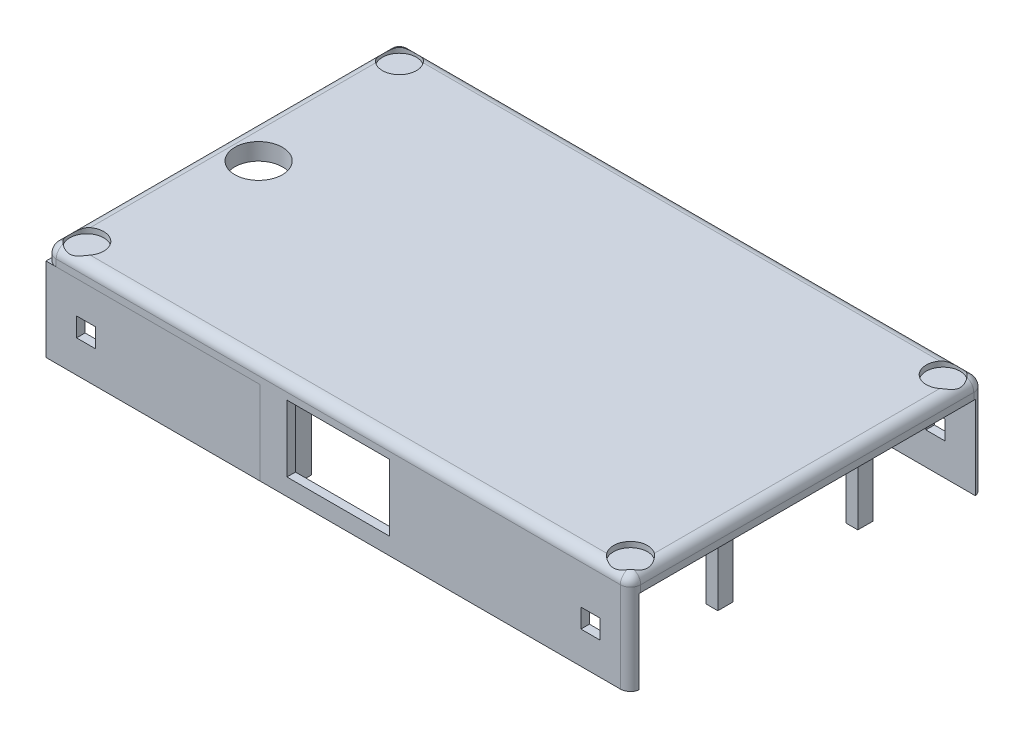
from build123d import *

# Parameters (mm, degrees)
ESBO_O1_W                 = 172
ESBO_O1_H                 = 104
RESSALTO_EXTRUS_O1_DEPTH  = 5
ESBO_O6_W                 = 63.01
ESBO_O6_H                 = 24.6
RESSALTO_EXTRUS_O3_DEPTH  = 2.5
ESBO_O9_W                 = 5.6
ESBO_O9_H                 = 5.6
CORTE_EXTRUS_O1_DEPTH     = 5
ESBO_O10_W                = 63
ESBO_O10_H                = 24.6
RESSALTO_EXTRUS_O4_DEPTH  = 2.5
ESBO_O11_W                = 5.6
ESBO_O11_H                = 5.6
CORTE_EXTRUS_O2_DEPTH     = 5
ESBO_O12_W                = 63
ESBO_O12_H                = 24.6
RESSALTO_EXTRUS_O5_DEPTH  = 2.5
ESBO_O15_W                = 63
ESBO_O15_H                = 24.6
RESSALTO_EXTRUS_O6_DEPTH  = 2.5
ESBO_O18_W                = 5.6
ESBO_O18_H                = 5.6
CORTE_EXTRUS_O5_DEPTH     = 10
ESBO_O19_W                = 5.6
ESBO_O19_H                = 5.6
CORTE_EXTRUS_O6_DEPTH     = 10
ESBO_O20_W                = 7.9
ESBO_O20_H                = 24.6
RESSALTO_EXTRUS_O7_DEPTH  = 2.5
ESBO_O21_W                = 7.89
ESBO_O21_H                = 24.6
RESSALTO_EXTRUS_O8_DEPTH  = 2.5
ESBO_O25_W                = 3.92
ESBO_O25_H                = 6.6
RESSALTO_EXTRUS_O9_DEPTH  = 24.6
ESBO_O27_W                = 3.92
ESBO_O27_H                = 6.6
RESSALTO_EXTRUS_O10_DEPTH = 24.6
ESBO_O28_W                = 2.5
ESBO_O28_H                = 5
RESSALTO_EXTRUS_O11_DEPTH = 30.6
ESBO_O29_W                = 7.9
ESBO_O29_H                = 24.6
RESSALTO_EXTRUS_O12_DEPTH = 2.5
ESBO_O30_W                = 7.9
ESBO_O30_H                = 24.6
RESSALTO_EXTRUS_O13_DEPTH = 2.5
ESBO_O31_W                = 3.92
ESBO_O31_H                = 6.6
RESSALTO_EXTRUS_O14_DEPTH = 24.6
ESBO_O32_W                = 3.92
ESBO_O32_H                = 4.1
RESSALTO_EXTRUS_O15_DEPTH = 24.6
ESBO_O34_W                = 30.2
ESBO_O34_H                = 5
RESSALTO_EXTRUS_O16_DEPTH = 2.5
FILETE3_R                 = 3
FILETE4_R                 = 3
FILETE5_R                 = 3
FILETE6_R                 = 3
ESBO_O53_R                = 7
CORTE_EXTRUS_O12_DEPTH    = 134
ESBO_O55_W                = 3.5
ESBO_O55_H                = 4.5
RESSALTO_EXTRUS_O29_DEPTH = 20.1
ESBO_O57_W                = 3.5
ESBO_O57_H                = 4.5
RESSALTO_EXTRUS_O30_DEPTH = 20.1
ESBO_O58_W                = 3.5
ESBO_O58_H                = 36.697857
RESSALTO_EXTRUS_O31_DEPTH = 4
ESBO_O49_R                = 5
CORTE_EXTRUS_O13_DEPTH    = 1.6
ESBO_O47_R                = 5
CORTE_EXTRUS_O14_DEPTH    = 1.6
ESBO_O44_R                = 5
CORTE_EXTRUS_O15_DEPTH    = 1.6
ESBO_O48_R                = 5
CORTE_EXTRUS_O16_DEPTH    = 1.6


with BuildPart() as part:
    # Esboço1 → Ressalto-extrusão1 (new body)
    with BuildSketch(Plane(origin=(0, 0, 0), x_dir=(1, 0, 0), z_dir=(0, 1, 0))):
        with Locations((-16.61286323, 0.238185856)):
            Rectangle(ESBO_O1_W, ESBO_O1_H)
    extrude(amount=RESSALTO_EXTRUS_O1_DEPTH)



with BuildPart() as body_2:
    # Esboço6 → Ressalto-extrusão3 (new body)
    with BuildSketch(Plane.XY.offset(51.761814144)):
        with Locations((-71.10786323, -12.3)):
            Rectangle(ESBO_O6_W, ESBO_O6_H)
    extrude(amount=-RESSALTO_EXTRUS_O3_DEPTH)

    # Esboço9 → Corte-extrusão1 (cut)
    with BuildSketch(Plane(origin=(0, 0, 49.261814144), x_dir=(-1, 0, 0), z_dir=(0, 0, -1))):
        with Locations((90.81286323, -12.3)):
            Rectangle(ESBO_O9_W, ESBO_O9_H)
    extrude(amount=-CORTE_EXTRUS_O1_DEPTH, mode=Mode.SUBTRACT)


with BuildPart() as body_3:
    # Esboço10 → Ressalto-extrusão4 (new body)
    with BuildSketch(Plane(origin=(0, 0, -52.238185856), x_dir=(-1, 0, 0), z_dir=(0, 0, -1))):
        with Locations((71.11286323, -12.3)):
            Rectangle(ESBO_O10_W, ESBO_O10_H)
    extrude(amount=-RESSALTO_EXTRUS_O4_DEPTH)

    # Esboço11 → Corte-extrusão2 (cut)
    with BuildSketch(Plane.XY.offset(-49.738185856)):
        with Locations((-90.81286323, -12.3)):
            Rectangle(ESBO_O11_W, ESBO_O11_H)
    extrude(amount=-CORTE_EXTRUS_O2_DEPTH, mode=Mode.SUBTRACT)


with BuildPart() as body_4:
    # Esboço12 → Ressalto-extrusão5 (new body)
    with BuildSketch(Plane(origin=(0, 0, -52.238185856), x_dir=(-1, 0, 0), z_dir=(0, 0, -1))):
        with Locations((-37.88713677, -12.3)):
            Rectangle(ESBO_O12_W, ESBO_O12_H)
    extrude(amount=-RESSALTO_EXTRUS_O5_DEPTH)

    # Esboço18 → Corte-extrusão5 (cut)
    with BuildSketch(Plane(origin=(0, 0, -52.238185856), x_dir=(-1, 0, 0), z_dir=(0, 0, -1))):
        with Locations((-57.58713677, -12.3)):
            Rectangle(ESBO_O18_W, ESBO_O18_H)
    extrude(amount=-CORTE_EXTRUS_O5_DEPTH, mode=Mode.SUBTRACT)


with BuildPart() as body_5:
    # Esboço15 → Ressalto-extrusão6 (new body)
    with BuildSketch(Plane.XY.offset(51.761814144)):
        with Locations((37.88713677, -12.3)):
            Rectangle(ESBO_O15_W, ESBO_O15_H)
    extrude(amount=-RESSALTO_EXTRUS_O6_DEPTH)

    # Esboço19 → Corte-extrusão6 (cut)
    with BuildSketch(Plane.XY.offset(51.761814144)):
        with Locations((57.58713677, -12.3)):
            Rectangle(ESBO_O19_W, ESBO_O19_H)
    extrude(amount=-CORTE_EXTRUS_O6_DEPTH, mode=Mode.SUBTRACT)


with BuildPart() as part_1:
    add(part.part)

    add(body_5.part)  # Ressalto-extrusão7 merges body 5
    # Esboço20 → Ressalto-extrusão7 (add)
    with BuildSketch(Plane.XY.offset(51.761814144)):
        with Locations((2.43713677, -12.3)):
            Rectangle(ESBO_O20_W, ESBO_O20_H)
    extrude(amount=-RESSALTO_EXTRUS_O7_DEPTH)

    # Esboço25 → Ressalto-extrusão9 (add)
    with BuildSketch(Plane.XZ):
        with Locations((2.34713677, 45.961814144)):
            Rectangle(ESBO_O25_W, ESBO_O25_H)
    extrude(amount=RESSALTO_EXTRUS_O9_DEPTH)



with BuildPart() as body_5_2:
    # Esboço21 → Ressalto-extrusão8 (new body)
    with BuildSketch(Plane.XY.offset(51.761814144)):
        with Locations((-35.65786323, -12.3)):
            Rectangle(ESBO_O21_W, ESBO_O21_H)
    extrude(amount=-RESSALTO_EXTRUS_O8_DEPTH)


with BuildPart() as part_2:
    add(part_1.part)

    add(body_5_2.part)  # Ressalto-extrusão10 merges body 5 2
    # Esboço27 → Ressalto-extrusão10 (add)
    with BuildSketch(Plane.XZ):
        with Locations((-35.57286323, 45.961814144)):
            Rectangle(ESBO_O27_W, ESBO_O27_H)
    extrude(amount=RESSALTO_EXTRUS_O10_DEPTH)

    # Esboço28 → Ressalto-extrusão11 (add)
    with BuildSketch(Plane(origin=(-31.71286323, 0, 0), x_dir=(0, 0, -1), z_dir=(1, 0, 0))):
        with Locations((-50.511814144, -22.1)):
            Rectangle(ESBO_O28_W, ESBO_O28_H)
    extrude(amount=RESSALTO_EXTRUS_O11_DEPTH)


    add(body_3.part)  # Ressalto-extrusão12 merges body 3
    # Esboço29 → Ressalto-extrusão12 (add)
    with BuildSketch(Plane(origin=(0, 0, -52.238185856), x_dir=(-1, 0, 0), z_dir=(0, 0, -1))):
        with Locations((35.66286323, -12.3)):
            Rectangle(ESBO_O29_W, ESBO_O29_H)
    extrude(amount=-RESSALTO_EXTRUS_O12_DEPTH)


    add(body_4.part)  # Ressalto-extrusão13 merges body 4
    # Esboço30 → Ressalto-extrusão13 (add)
    with BuildSketch(Plane(origin=(0, 0, -52.238185856), x_dir=(-1, 0, 0), z_dir=(0, 0, -1))):
        with Locations((-2.43713677, -12.3)):
            Rectangle(ESBO_O30_W, ESBO_O30_H)
    extrude(amount=-RESSALTO_EXTRUS_O13_DEPTH)

    # Esboço31 → Ressalto-extrusão14 (add)
    with BuildSketch(Plane.XZ):
        with Locations((-35.57286323, -46.438185856)):
            Rectangle(ESBO_O31_W, ESBO_O31_H)
    extrude(amount=RESSALTO_EXTRUS_O14_DEPTH)

    # Esboço32 → Ressalto-extrusão15 (add)
    with BuildSketch(Plane.XZ):
        with Locations((2.34713677, -47.688185856)):
            Rectangle(ESBO_O32_W, ESBO_O32_H)
    extrude(amount=RESSALTO_EXTRUS_O15_DEPTH)

    # Esboço34 → Ressalto-extrusão16 (add)
    with BuildSketch(Plane(origin=(0, 0, -52.238185856), x_dir=(-1, 0, 0), z_dir=(0, 0, -1))):
        with Locations((16.61286323, -22.1)):
            Rectangle(ESBO_O34_W, ESBO_O34_H)
    extrude(amount=-RESSALTO_EXTRUS_O16_DEPTH)

    # Filete3
    filete3_edges = [part_2.edges().sort_by_distance(p)[0] for p in [
        (-16.61286323, 5, 51.761814144),
    ]]
    fillet(filete3_edges, radius=FILETE3_R)

    # Filete4
    filete4_edges = [part_2.edges().sort_by_distance(p)[0] for p in [
        (69.38713677, -11.3, 51.761814144),
        (69.38713677, 4.121320344, 50.883134488),
        (69.38713677, 5, -1.738185856),
    ]]
    fillet(filete4_edges, radius=FILETE4_R)

    # Filete5
    filete5_edges = [part_2.edges().sort_by_distance(p)[0] for p in [
        (69.38713677, -11.3, -52.238185856),
        (68.508457113, 4.121320344, -52.238185856),
        (-18.11286323, 5, -52.238185856),
    ]]
    fillet(filete5_edges, radius=FILETE5_R)

    # Filete6
    filete6_edges = [part_2.edges().sort_by_distance(p)[0] for p in [
        (-102.61286323, -11.3, -52.238185856),
        (-102.61286323, 4.121320344, -51.359506199),
        (-102.61286323, 1, 51.761814144),
        (-102.61286323, 4.121320344, 50.883134488),
        (-102.61286323, 5, -0.238185856),
    ]]
    fillet(filete6_edges, radius=FILETE6_R)

    # Esboço53 → Corte-extrusão12 (cut)
    with BuildSketch(Plane.XZ):
        with Locations(Location((-91.814067068, 0, 0), (0, 0, 270))):
            Circle(ESBO_O53_R)
    extrude(amount=-CORTE_EXTRUS_O12_DEPTH, mode=Mode.SUBTRACT)

    # Esboço55 → Ressalto-extrusão29 (add)
    with BuildSketch(Plane.XZ):
        with Locations((63.516746102, 19.708050032)):
            Rectangle(ESBO_O55_W, ESBO_O55_H)
    extrude(amount=RESSALTO_EXTRUS_O29_DEPTH)

    # Esboço57 → Ressalto-extrusão30 (add)
    with BuildSketch(Plane.XZ):
        with Locations((63.51713677, -21.488185856)):
            Rectangle(ESBO_O57_W, ESBO_O57_H)
    extrude(amount=RESSALTO_EXTRUS_O30_DEPTH)

    # Esboço58 → Ressalto-extrusão31 (add)
    with BuildSketch(Plane(origin=(0, 0, 0), x_dir=(-1, 0, 0), z_dir=(0, -1, 0))):
        with Locations((-63.51713677, 0.890878468)):
            Rectangle(ESBO_O58_W, ESBO_O58_H)
    extrude(amount=RESSALTO_EXTRUS_O31_DEPTH)

    # Esboço49 → Corte-extrusão13 (cut)
    with BuildSketch(Plane(origin=(0, 5, 0), x_dir=(1, 0, 0), z_dir=(0, 1, 0))):
        with Locations(Location((63.38713677, 46.238185856, 0), (0, 0, 270))):
            Circle(ESBO_O49_R)
    extrude(amount=-CORTE_EXTRUS_O13_DEPTH, mode=Mode.SUBTRACT)

    # Esboço47 → Corte-extrusão14 (cut)
    with BuildSketch(Plane(origin=(0, 5, 0), x_dir=(1, 0, 0), z_dir=(0, 1, 0))):
        with Locations(Location((-96.61286323, 46.238185856, 0), (0, 0, 270))):
            Circle(ESBO_O47_R)
    extrude(amount=-CORTE_EXTRUS_O14_DEPTH, mode=Mode.SUBTRACT)

    # Esboço44 → Corte-extrusão15 (cut)
    with BuildSketch(Plane(origin=(0, 5, 0), x_dir=(1, 0, 0), z_dir=(0, 1, 0))):
        with Locations(Location((-96.61286323, -45.761814144, 0), (0, 0, 270))):
            Circle(ESBO_O44_R)
    extrude(amount=-CORTE_EXTRUS_O15_DEPTH, mode=Mode.SUBTRACT)

    # Esboço48 → Corte-extrusão16 (cut)
    with BuildSketch(Plane(origin=(0, 5, 0), x_dir=(1, 0, 0), z_dir=(0, 1, 0))):
        with Locations(Location((63.38713677, -45.761814144, 0), (0, 0, 270))):
            Circle(ESBO_O48_R)
    extrude(amount=-CORTE_EXTRUS_O16_DEPTH, mode=Mode.SUBTRACT)


solid = Compound([body_2.part, part_2.part])
